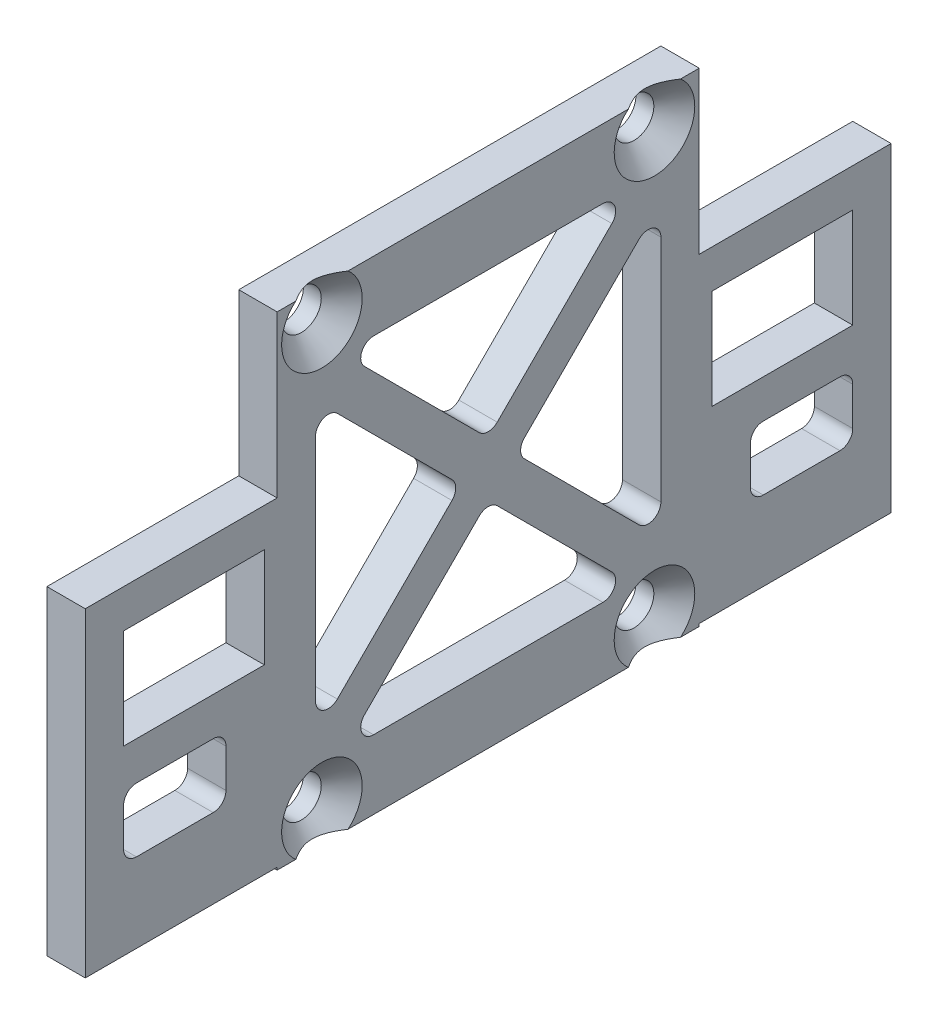
from build123d import *

# Parameters (mm, degrees)
SKETCH_1_R                  = 1.55
SKETCH_1_W                  = 8
SKETCH_1_H                  = 5
SKETCH_1_W_2                = 11
SKETCH_1_H_2                = 7.8
EXTRUDE_1_DEPTH             = 3
HOLE_WIZARD_M3_1_AT_2_COUNT = 2
HOLE_WIZARD_M3_1_AT_2_PITCH = 26
HOLE_WIZARD_M3_1_AT_3_COUNT = 2
HOLE_WIZARD_M3_1_AT_3_PITCH = 42.011903075
HOLE_WIZARD_M3_1_AT_4_COUNT = 2
HOLE_WIZARD_M3_1_AT_4_PITCH = 33
FILLET_1_R                  = 1


with BuildPart() as part:
    # 草图1 → 凸台-拉伸1 (new body)
    with BuildSketch(Plane(origin=(0, 0, 0), x_dir=(0, 0, -1), z_dir=(1, 0, 0))):
        Polygon((16.5, -18.9), (-16.5, -18.9), (-16.5, -18.7), (-31.5, -18.7), (-31.5, 6.3), (-16.5, 6.3), (-16.5, 18.9), (16.5, 18.9), (16.5, 6.3), (31.5, 6.3), (31.5, -18.7), (16.5, -18.7), align=None)
        with Locations((-13, 16.5)):
            Circle(SKETCH_1_R, mode=Mode.SUBTRACT)
        with Locations((-13, -16.5)):
            Circle(SKETCH_1_R, mode=Mode.SUBTRACT)
        with Locations(Location((13, -16.5, 0), (0, 0, 180))):
            Circle(SKETCH_1_R, mode=Mode.SUBTRACT)
        with Locations(Location((13, 16.5, 0), (0, 0, 180))):
            Circle(SKETCH_1_R, mode=Mode.SUBTRACT)
        with Locations((24.5, -10)):
            Rectangle(SKETCH_1_W, SKETCH_1_H, mode=Mode.SUBTRACT)
        with Locations((-24.5, -10)):
            Rectangle(SKETCH_1_W, SKETCH_1_H, mode=Mode.SUBTRACT)
        Polygon((-13.5, -11.378679656), (-2.121320344, 0), (-13.5, 11.378679656), align=None, mode=Mode.SUBTRACT)
        Polygon((-11.378679656, -13.5), (0, -2.121320344), (11.378679656, -13.5), align=None, mode=Mode.SUBTRACT)
        Polygon((-11.378679656, 13.5), (0, 2.121320344), (11.378679656, 13.5), align=None, mode=Mode.SUBTRACT)
        Polygon((13.5, 11.378679656), (13.5, -11.378679656), (2.121320344, 0), align=None, mode=Mode.SUBTRACT)
        with Locations((23, -0.6)):
            Rectangle(SKETCH_1_W_2, SKETCH_1_H_2, mode=Mode.SUBTRACT)
        with Locations((-23, -0.6)):
            Rectangle(SKETCH_1_W_2, SKETCH_1_H_2, mode=Mode.SUBTRACT)
    extrude(amount=EXTRUDE_1_DEPTH)

    # 草图2 → M3 锥坑高头螺钉的锥形沉头孔1 (revolve, cut)
    with BuildSketch(Plane(origin=(3, 16.5, 13), x_dir=(0, 0, -1), z_dir=(0, 1, 0))):
        Polygon((0, 0), (0, 3), (1.55, 3), (1.55, 1.6), (3.15, 0), align=None)
    hole_wizard_m3_1 = revolve(axis=Axis((9.35, 16.5, 13), (-1, 0, 0)), mode=Mode.SUBTRACT)

    # M3 锥坑高头螺钉的锥形沉头孔1 at 2: M3 锥坑高头螺钉的锥形沉头孔1 ×2
    with Locations(*[(0, 0, -i * HOLE_WIZARD_M3_1_AT_2_PITCH) for i in range(1, HOLE_WIZARD_M3_1_AT_2_COUNT)]):
        add(hole_wizard_m3_1, mode=Mode.SUBTRACT)

    # M3 锥坑高头螺钉的锥形沉头孔1 at 3: M3 锥坑高头螺钉的锥形沉头孔1 ×2
    with Locations(*[Vector(0, -0.7854916722275357, -0.6188722266035129) * (i * HOLE_WIZARD_M3_1_AT_3_PITCH) for i in range(1, HOLE_WIZARD_M3_1_AT_3_COUNT)]):
        add(hole_wizard_m3_1, mode=Mode.SUBTRACT)

    # M3 锥坑高头螺钉的锥形沉头孔1 at 4: M3 锥坑高头螺钉的锥形沉头孔1 ×2
    with Locations(*[(0, -i * HOLE_WIZARD_M3_1_AT_4_PITCH, 0) for i in range(1, HOLE_WIZARD_M3_1_AT_4_COUNT)]):
        add(hole_wizard_m3_1, mode=Mode.SUBTRACT)

    # 圆角1
    fillet_1_edges = [part.edges().sort_by_distance(p)[0] for p in [
        (1.5, 11.378679656, -13.5),
        (1.5, 0, -2.121320344),
        (1.5, -11.378679656, -13.5),
        (1.5, -12.5, 20.5),
        (1.5, -7.5, 20.5),
        (1.5, -7.5, 28.5),
        (1.5, -12.5, 28.5),
        (1.5, -12.5, -28.5),
        (1.5, -7.5, -28.5),
        (1.5, -7.5, -20.5),
        (1.5, -12.5, -20.5),
        (1.5, 11.378679656, 13.5),
        (1.5, -11.378679656, 13.5),
        (1.5, 0, 2.121320344),
        (1.5, 2.121320344, 0),
        (1.5, 13.5, -11.378679656),
        (1.5, 13.5, 11.378679656),
        (1.5, -13.5, 11.378679656),
        (1.5, -13.5, -11.378679656),
        (1.5, -2.121320344, 0),
    ]]
    fillet(fillet_1_edges, radius=FILLET_1_R)


solid = part.part
